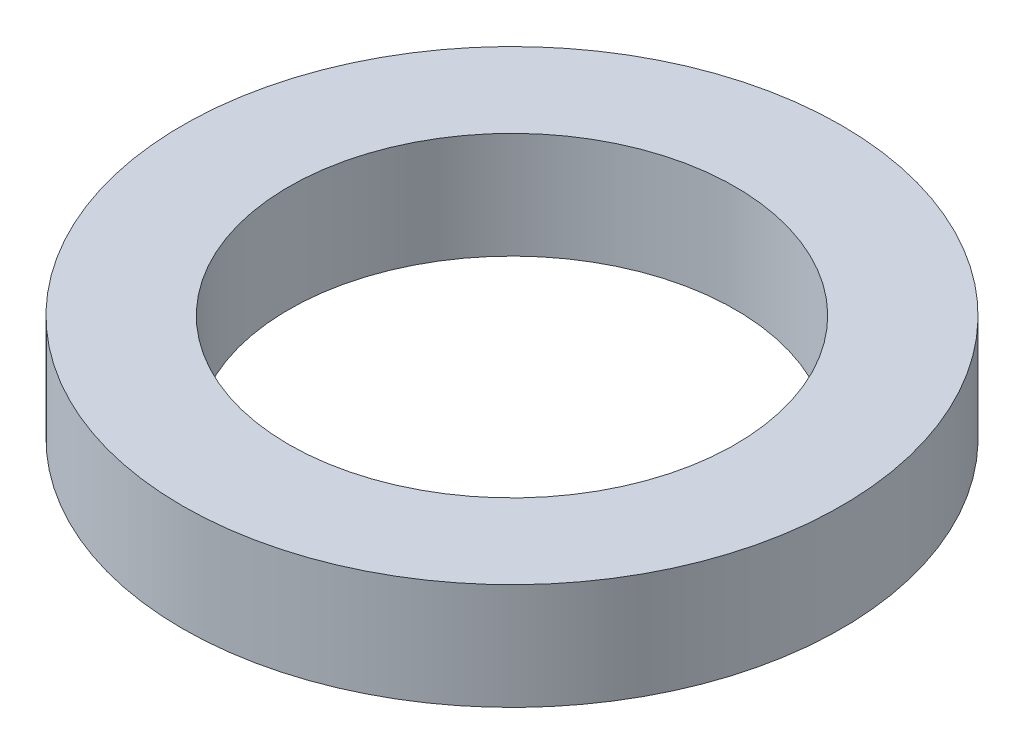
from build123d import *

# Parameters (mm, degrees)
SKETCH1_R           = 3.1
SKETCH1_R_2         = 2.1
BOSS_EXTRUDE1_DEPTH = 1


with BuildPart() as part:
    # Sketch1 → Boss-Extrude1 (new body)
    with BuildSketch(Plane(origin=(0, 0, 0), x_dir=(1, 0, 0), z_dir=(0, 1, 0))):
        with Locations(Location((0, 0, 0), (0, 0, 270))):
            Circle(SKETCH1_R)
        with Locations(Location((0, 0, 0), (0, 0, 270))):
            Circle(SKETCH1_R_2, mode=Mode.SUBTRACT)
    extrude(amount=BOSS_EXTRUDE1_DEPTH)


solid = part.part
